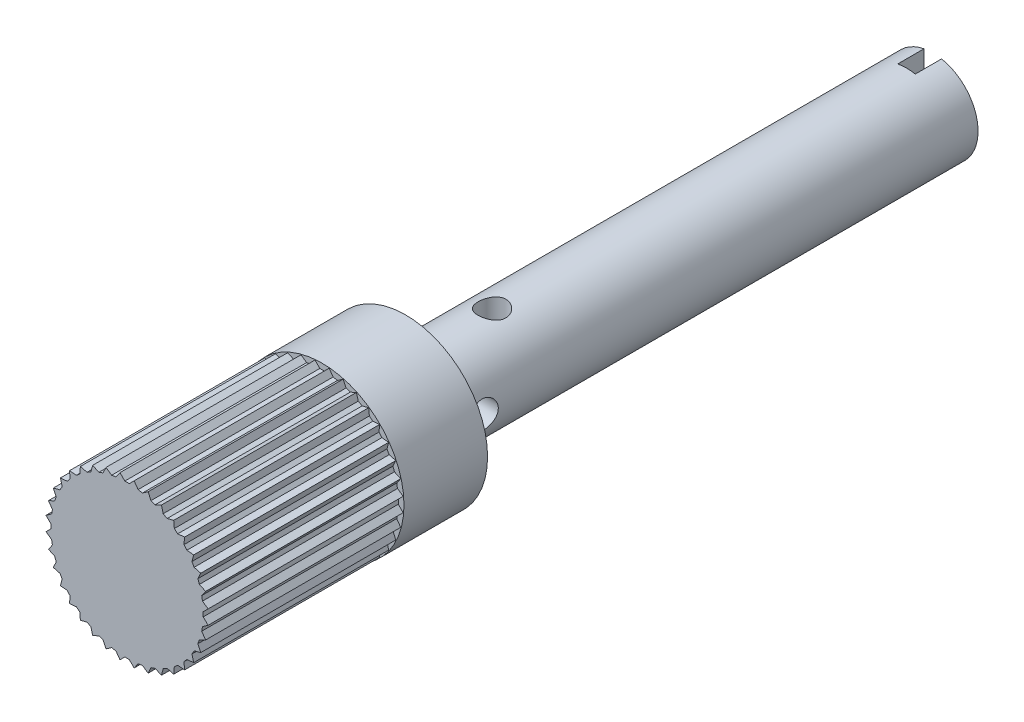
from build123d import *

# Parameters (mm, degrees)
SKETCH5_W                = 5.15874
SKETCH5_H                = 60.071
SKETCH10_R               = 9.3345
BOSS_EXTRUDE1_DEPTH      = 31.75
CUT_EXTRUDE7_START       = 91.821
SKETCH8_R                = 12.7
CUT_EXTRUDE7_DEPTH       = 22.225
CUT_EXTRUDE9_DEPTH       = 93.765089454
CUT_EXTRUDE9_DEPTH_BACK  = 93.765089454
SKETCH11_W               = 2
SKETCH11_H               = 3
CUT_EXTRUDE10_DEPTH      = 93.765089454
CUT_EXTRUDE10_DEPTH_BACK = 93.765089454
SKETCH12_R               = 1.5875
CUT_EXTRUDE11_DEPTH      = 93.765089454
CUT_EXTRUDE11_DEPTH_BACK = 93.765089454
SKETCH13_R               = 1.5875


with BuildPart() as part:
    # Sketch5 → Revolve2 (revolve)
    with BuildSketch(Plane(origin=(0, 0, 0), x_dir=(1, 0, 0), z_dir=(0, 1, 0)), mode=Mode.PRIVATE) as revolve2_sk:
        with Locations((2.57937, -30.0355)):
            Rectangle(SKETCH5_W, SKETCH5_H)
    revolve(revolve2_sk.sketch.rotate(Axis((0, 0, 0), (0, 0, 1)), 180), axis=Axis((0, 0, 0), (0, 0, 1)))

    # Sketch10 → Boss-Extrude1 (add)
    with BuildSketch(Plane.XY.offset(60.071)):
        Circle(SKETCH10_R)
    extrude(amount=BOSS_EXTRUDE1_DEPTH)

    # Sketch8 → Cut-Extrude7 (cut)
    with BuildSketch(Plane.XY.offset(CUT_EXTRUDE7_START)):
        Circle(SKETCH8_R)
        Polygon((9.235721046, -0.808020891), (8.681700155, -0.254), (8.681700155, 0.254), (9.235721046, 0.808020891), (8.593912259, 1.257420242), (8.505698985, 1.75770258), (8.955098336, 2.399511367), (8.245002688, 2.730634406), (8.071256455, 3.207998257), (8.402379494, 3.918093905), (7.645572882, 4.120879625), (7.391572882, 4.56082053), (7.594358603, 5.317627141), (6.813836213, 5.385914002), (6.487300108, 5.775064579), (6.555586968, 6.555586968), (5.775064579, 6.487300108), (5.385914002, 6.813836213), (5.317627141, 7.594358603), (4.56082053, 7.391572882), (4.120879625, 7.645572882), (3.918093905, 8.402379494), (3.207998257, 8.071256455), (2.730634406, 8.245002688), (2.399511367, 8.955098336), (1.75770258, 8.505698985), (1.257420242, 8.593912259), (0.808020891, 9.235721046), (0.254, 8.681700155), (-0.254, 8.681700155), (-0.808020891, 9.235721046), (-1.257420242, 8.593912259), (-1.75770258, 8.505698985), (-2.399511367, 8.955098336), (-2.730634406, 8.245002688), (-3.207998257, 8.071256455), (-3.918093905, 8.402379494), (-4.120879625, 7.645572882), (-4.56082053, 7.391572882), (-5.317627141, 7.594358603), (-5.385914002, 6.813836213), (-5.775064579, 6.487300108), (-6.555586968, 6.555586968), (-6.487300108, 5.775064579), (-6.813836213, 5.385914002), (-7.594358603, 5.317627141), (-7.391572882, 4.56082053), (-7.645572882, 4.120879625), (-8.402379494, 3.918093905), (-8.071256455, 3.207998257), (-8.245002688, 2.730634406), (-8.955098336, 2.399511367), (-8.505698985, 1.75770258), (-8.593912259, 1.257420242), (-9.235721046, 0.808020891), (-8.681700155, 0.254), (-8.681700155, -0.254), (-9.235721046, -0.808020891), (-8.593912259, -1.257420242), (-8.505698985, -1.75770258), (-8.955098336, -2.399511367), (-8.245002688, -2.730634406), (-8.071256455, -3.207998257), (-8.402379494, -3.918093905), (-7.645572882, -4.120879625), (-7.391572882, -4.56082053), (-7.594358603, -5.317627141), (-6.813836213, -5.385914002), (-6.487300108, -5.775064579), (-6.555586968, -6.555586968), (-5.775064579, -6.487300108), (-5.385914002, -6.813836213), (-5.317627141, -7.594358603), (-4.56082053, -7.391572882), (-4.120879625, -7.645572882), (-3.918093905, -8.402379494), (-3.207998257, -8.071256455), (-2.730634406, -8.245002688), (-2.399511367, -8.955098336), (-1.75770258, -8.505698985), (-1.257420242, -8.593912259), (-0.808020891, -9.235721046), (-0.254, -8.681700155), (0.254, -8.681700155), (0.808020891, -9.235721046), (1.257420242, -8.593912259), (1.75770258, -8.505698985), (2.399511367, -8.955098336), (2.730634406, -8.245002688), (3.207998257, -8.071256455), (3.918093905, -8.402379494), (4.120879625, -7.645572882), (4.56082053, -7.391572882), (5.317627141, -7.594358603), (5.385914002, -6.813836213), (5.775064579, -6.487300108), (6.555586968, -6.555586968), (6.487300108, -5.775064579), (6.813836213, -5.385914002), (7.594358603, -5.317627141), (7.391572882, -4.56082053), (7.645572882, -4.120879625), (8.402379494, -3.918093905), (8.071256455, -3.207998257), (8.245002688, -2.730634406), (8.955098336, -2.399511367), (8.505698985, -1.75770258), (8.593912259, -1.257420242), align=None, mode=Mode.SUBTRACT)
    extrude(amount=-CUT_EXTRUDE7_DEPTH, mode=Mode.SUBTRACT)

    # Sketch11 → Cut-Extrude9 (cut, two sides: drawn at the far end of the back side and taken through both)
    with BuildSketch(Plane(origin=(0, 0, 0), x_dir=(1, 0, 0), z_dir=(0, 1, 0)).offset(-CUT_EXTRUDE9_DEPTH_BACK)):
        with Locations((0, -1.5)):
            Rectangle(SKETCH11_W, SKETCH11_H)
    extrude(amount=CUT_EXTRUDE9_DEPTH + CUT_EXTRUDE9_DEPTH_BACK, mode=Mode.SUBTRACT)

    # Sketch12 → Cut-Extrude10 (cut, two sides: drawn at the far end of the back side and taken through both)
    with BuildSketch(Plane(origin=(0, 0, 0), x_dir=(1, 0, 0), z_dir=(0, 1, 0)).offset(-CUT_EXTRUDE10_DEPTH_BACK)):
        with Locations(Location((0, -50.2285, 0), (0, 0, 270))):
            Circle(SKETCH12_R)
    extrude(amount=CUT_EXTRUDE10_DEPTH + CUT_EXTRUDE10_DEPTH_BACK, mode=Mode.SUBTRACT)

    # Sketch13 → Cut-Extrude11 (cut, two sides: drawn at the far end of the back side and taken through both)
    with BuildSketch(Plane(origin=(0, 0, 0), x_dir=(0, 0, -1), z_dir=(1, 0, 0)).offset(-CUT_EXTRUDE11_DEPTH_BACK)):
        with Locations((-56.261, 0)):
            Circle(SKETCH13_R)
    extrude(amount=CUT_EXTRUDE11_DEPTH + CUT_EXTRUDE11_DEPTH_BACK, mode=Mode.SUBTRACT)


solid = part.part
